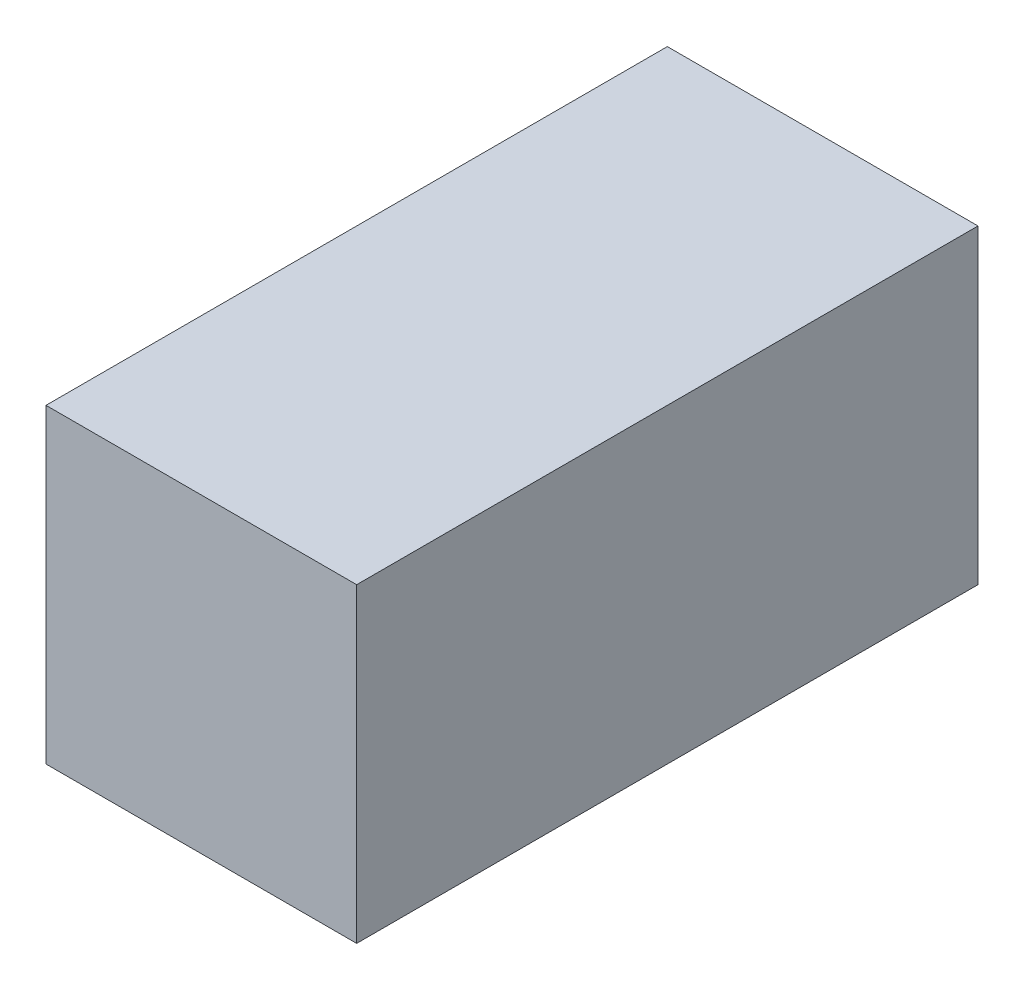
from build123d import *

# Parameters (mm, degrees)
SCHIZZO1_W                   = 10
SCHIZZO1_H                   = 10
ESTRUSIONE_ESTRUSIONE1_DEPTH = 20


with BuildPart() as part:
    # Schizzo1 → Estrusione-Estrusione1 (new body)
    with BuildSketch(Plane.XY):
        Rectangle(SCHIZZO1_W, SCHIZZO1_H)
    extrude(amount=ESTRUSIONE_ESTRUSIONE1_DEPTH)


solid = part.part
